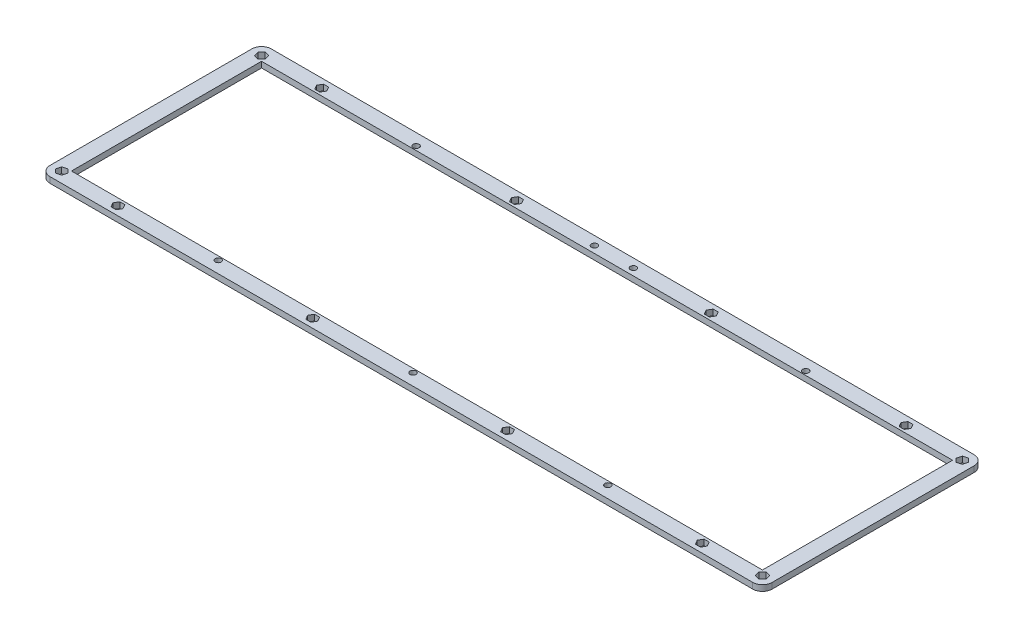
from build123d import *

# Parameters (mm, degrees)
SKETCH1_R           = 1.55
SKETCH1_W           = 354.775
SKETCH1_H           = 97.6
BOSS_EXTRUDE1_DEPTH = 3


with BuildPart() as part:
    # Sketch1 → Boss-Extrude1 (new body)
    with BuildSketch(Plane(origin=(0, 0, 0), x_dir=(1, 0, 0), z_dir=(0, 1, 0))):
        with BuildLine():
            Line((-2.165e-06, 108.600001782), (-2.165e-06, 5.000001782))
            ThreePointArc((-2.165e-06, 5.000001782), (1.464463929, 1.464467876), (4.999997835, 1.782e-06))
            Line((4.999997835, 1.782e-06), (365.774997835, 1.782e-06))
            ThreePointArc((365.774997835, 1.782e-06), (369.31053174, 1.464467876), (370.774997835, 5.000001782))
            Line((370.774997835, 5.000001782), (370.774997835, 108.600001782))
            ThreePointArc((370.774997835, 108.600001782), (369.31053174, 112.135535688), (365.774997835, 113.600001782))
            Line((365.774997835, 113.600001782), (4.999997835, 113.600001782))
            ThreePointArc((4.999997835, 113.600001782), (1.464463929, 112.135535688), (-2.165e-06, 108.600001782))
        make_face()
        with Locations(Location((195.387497835, 109.100001782, 0), (0, 0, 270))):
            Circle(SKETCH1_R, mode=Mode.SUBTRACT)
        with Locations(Location((175.387497835, 109.100001782, 0), (0, 0, 270))):
            Circle(SKETCH1_R, mode=Mode.SUBTRACT)
        with Locations(Location((85.387497835, 107.600001782, 0), (0, 0, 270))):
            Circle(SKETCH1_R, mode=Mode.SUBTRACT)
        with Locations(Location((285.387497835, 107.600001782, 0), (0, 0, 270))):
            Circle(SKETCH1_R, mode=Mode.SUBTRACT)
        with Locations(Location((85.387497835, 6.000001782, 0), (0, 0, 270))):
            Circle(SKETCH1_R, mode=Mode.SUBTRACT)
        with Locations(Location((185.387497835, 6.000001782, 0), (0, 0, 270))):
            Circle(SKETCH1_R, mode=Mode.SUBTRACT)
        with Locations(Location((285.387497835, 6.000001782, 0), (0, 0, 270))):
            Circle(SKETCH1_R, mode=Mode.SUBTRACT)
        with Locations((185.387497835, 56.800001782)):
            Rectangle(SKETCH1_W, SKETCH1_H, mode=Mode.SUBTRACT)
        Polygon((234.088459729, 111.350001782), (236.68653594, 111.350001782), (237.985574046, 109.100001782), (236.68653594, 106.850001782), (234.088459729, 106.850001782), (232.789421623, 109.100001782), align=None, mode=Mode.SUBTRACT)
        Polygon((334.088459729, 111.350001782), (336.68653594, 111.350001782), (337.985574046, 109.100001782), (336.68653594, 106.850001782), (334.088459729, 106.850001782), (332.789421623, 109.100001782), align=None, mode=Mode.SUBTRACT)
        Polygon((365.947429439, 110.609550693), (367.784546746, 108.772433386), (367.112115142, 106.262884475), (364.60256623, 105.590452871), (362.765448923, 107.427570178), (363.437880527, 109.937119089), align=None, mode=Mode.SUBTRACT)
        Polygon((136.68653594, 111.350001782), (134.088459729, 111.350001782), (132.789421623, 109.100001782), (134.088459729, 106.850001782), (136.68653594, 106.850001782), (137.985574046, 109.100001782), align=None, mode=Mode.SUBTRACT)
        Polygon((36.68653594, 111.350001782), (34.088459729, 111.350001782), (32.789421623, 109.100001782), (34.088459729, 106.850001782), (36.68653594, 106.850001782), (37.985574046, 109.100001782), align=None, mode=Mode.SUBTRACT)
        Polygon((4.82756623, 110.609550693), (2.990448923, 108.772433386), (3.662880527, 106.262884475), (6.172429439, 105.590452871), (8.009546746, 107.427570178), (7.337115142, 109.937119089), align=None, mode=Mode.SUBTRACT)
        Polygon((234.088459729, 2.250001782), (236.68653594, 2.250001782), (237.985574046, 4.500001782), (236.68653594, 6.750001782), (234.088459729, 6.750001782), (232.789421623, 4.500001782), align=None, mode=Mode.SUBTRACT)
        Polygon((334.088459729, 2.250001782), (336.68653594, 2.250001782), (337.985574046, 4.500001782), (336.68653594, 6.750001782), (334.088459729, 6.750001782), (332.789421623, 4.500001782), align=None, mode=Mode.SUBTRACT)
        Polygon((365.947429439, 2.990452871), (367.784546746, 4.827570178), (367.112115142, 7.337119089), (364.60256623, 8.009550693), (362.765448923, 6.172433386), (363.437880527, 3.662884475), align=None, mode=Mode.SUBTRACT)
        Polygon((136.68653594, 2.250001782), (134.088459729, 2.250001782), (132.789421623, 4.500001782), (134.088459729, 6.750001782), (136.68653594, 6.750001782), (137.985574046, 4.500001782), align=None, mode=Mode.SUBTRACT)
        Polygon((36.68653594, 2.250001782), (34.088459729, 2.250001782), (32.789421623, 4.500001782), (34.088459729, 6.750001782), (36.68653594, 6.750001782), (37.985574046, 4.500001782), align=None, mode=Mode.SUBTRACT)
        Polygon((4.82756623, 2.990452871), (2.990448923, 4.827570178), (3.662880527, 7.337119089), (6.172429439, 8.009550693), (8.009546746, 6.172433386), (7.337115142, 3.662884475), align=None, mode=Mode.SUBTRACT)
    extrude(amount=-BOSS_EXTRUDE1_DEPTH)


solid = part.part
